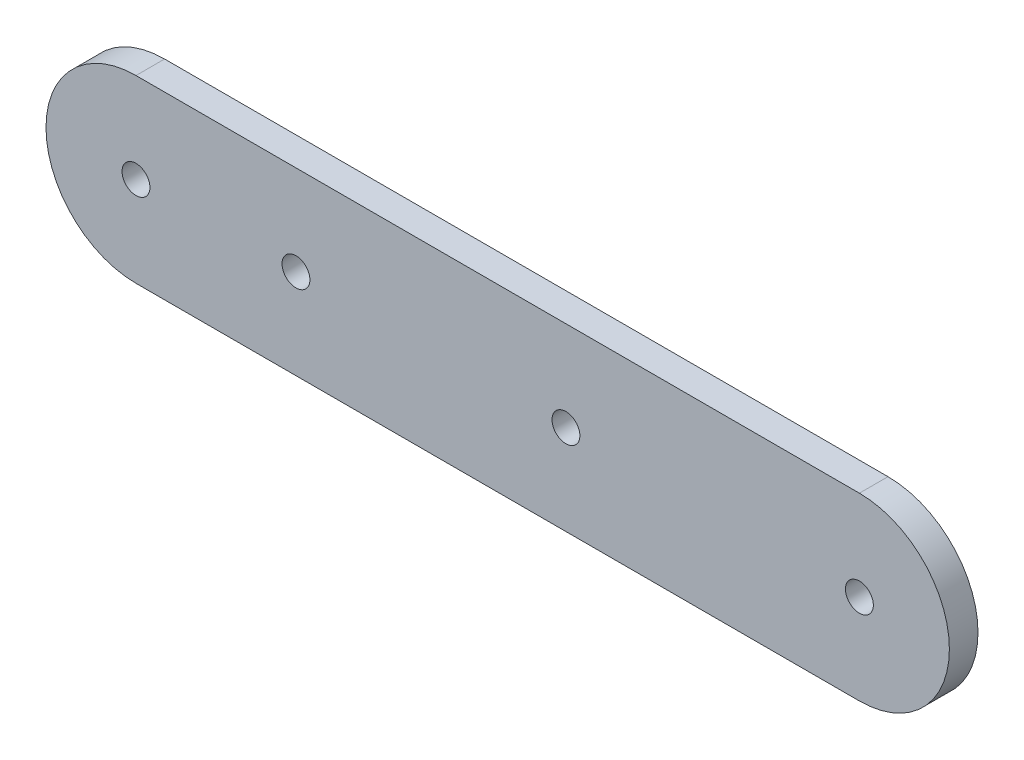
from build123d import *

# Parameters (mm, degrees)
BOSS_EXTRUDE1_DEPTH = 1.59
SKETCH6_R           = 1.55
CUT_EXTRUDE3_DEPTH  = 48.669302491
LPATTERN3_COUNT     = 3
LPATTERN3_PITCH     = 30
BOSS_EXTRUDE2_DEPTH = 1.59
SKETCH11_R          = 1.55
CUT_EXTRUDE7_DEPTH  = 57.396830198
SKETCH31_R          = 1.55
CUT_EXTRUDE14_DEPTH = 57.396830198


with BuildPart() as part:
    # Sketch1 → Boss-Extrude1 (new, symmetric)
    with BuildSketch(Plane.XY):
        with BuildLine():
            Line((-34.977997181, 10), (45.412002819, 10))
            ThreePointArc((45.412002819, 10), (46.5, 0), (45.412002819, -10))
            Line((45.412002819, -10), (-34.977997181, -10))
            ThreePointArc((-34.977997181, -10), (-44.977997181, 0), (-34.977997181, 10))
        make_face()
    extrude(amount=BOSS_EXTRUDE1_DEPTH, both=True)

    # Sketch6 → Cut-Extrude3 (cut, symmetric)
    with BuildSketch(Plane(origin=(0, 0, -1.59), x_dir=(-1, 0, 0), z_dir=(0, 0, -1))):
        with Locations((-12.8, 0)):
            Circle(SKETCH6_R)
    cut_extrude3 = extrude(amount=CUT_EXTRUDE3_DEPTH, both=True, mode=Mode.SUBTRACT)

    # LPattern3: Cut-Extrude3 ×3
    with Locations(*[(-i * LPATTERN3_PITCH, 0, 0) for i in range(1, LPATTERN3_COUNT)]):
        add(cut_extrude3, mode=Mode.SUBTRACT)

    # Sketch22 → Boss-Extrude2 (add, symmetric)
    with BuildSketch(Plane.XY):
        with BuildLine():
            ThreePointArc((45.412002819, -10), (46.5, 0), (45.412002819, 10))
            ThreePointArc((45.412002819, 10), (55.412002819, 0), (45.412002819, -10))
        make_face()
    extrude(amount=BOSS_EXTRUDE2_DEPTH, both=True)

    # Sketch11 → Cut-Extrude7 (cut, through all)
    with BuildSketch(Plane.XY.offset(1.59)):
        with Locations((-96.957997181, 0)):
            Circle(SKETCH11_R)
        with Locations((45.412002819, 0)):
            Circle(SKETCH11_R)
    extrude(amount=-CUT_EXTRUDE7_DEPTH, mode=Mode.SUBTRACT)

    # Sketch31 → Cut-Extrude14 (cut, through all)
    with BuildSketch(Plane.XY.offset(1.59)):
        with Locations((-34.977997181, 0)):
            Circle(SKETCH31_R)
    extrude(amount=-CUT_EXTRUDE14_DEPTH, mode=Mode.SUBTRACT)


solid = part.part
